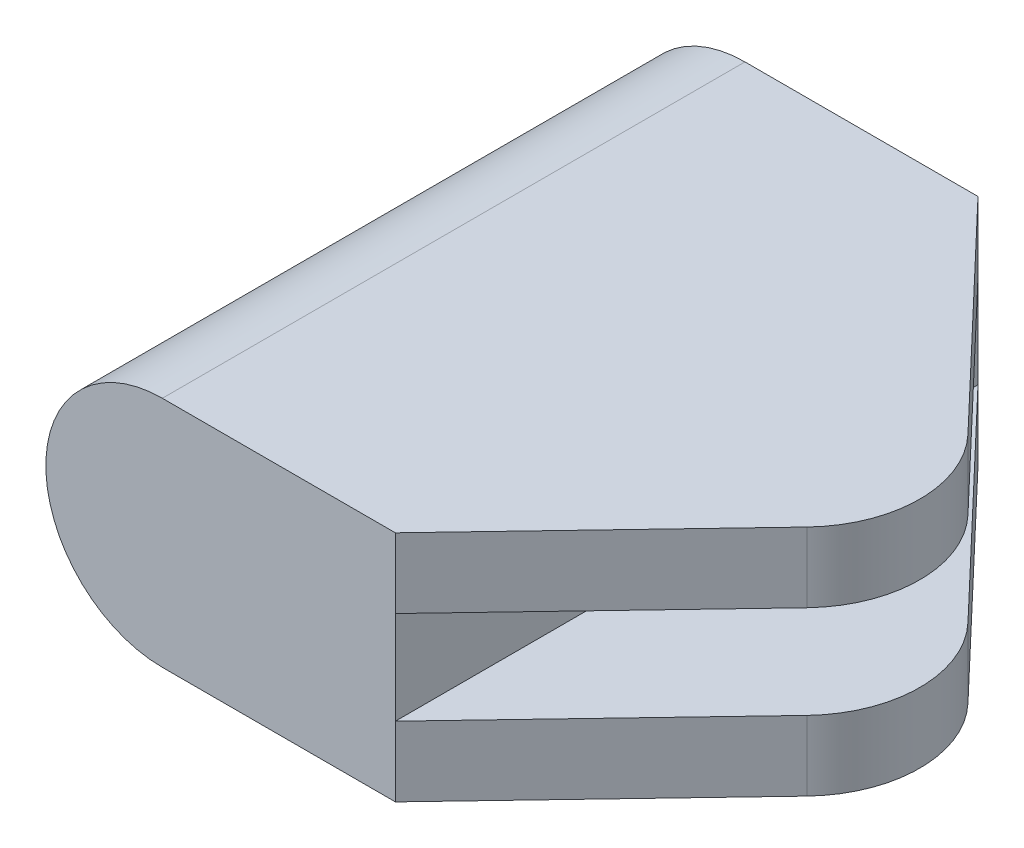
from build123d import *

# Parameters (mm, degrees)
EXTRUDE_1_DEPTH     = 100
CUT_EXTRUDE_1_DEPTH = 100
SKETCH_5_W          = 43.975139672
SKETCH_5_H          = 100.104675822
CUT_EXTRUDE_3_DEPTH = 8


with BuildPart() as part:
    # 草图2 → 凸台-拉伸1 (new body)
    with BuildSketch(Plane.XY):
        with BuildLine():
            Line((0, 20), (80, 20))
            Line((80, 20), (80, -20))
            Line((80, -20), (0, -20))
            ThreePointArc((0, -20), (-20, 0), (0, 20))
        make_face()
    extrude(amount=EXTRUDE_1_DEPTH)

    # 草图3 → 切除-拉伸1 (cut)
    with BuildSketch(Plane(origin=(0, 20, 0), x_dir=(1, 0, 0), z_dir=(0, 1, 0))):
        with BuildLine():
            Line((40, 0), (74.482758502, -36.206896811))
            ThreePointArc((74.482758502, -36.206896811), (79.999999735, -50), (74.482758502, -63.793103189))
            Line((74.482758502, -63.793103189), (40, -100))
            Line((40, -100), (91.714369415, -100))
            Line((91.714369415, -100), (91.714369415, 0))
            Line((91.714369415, 0), (40, 0))
        make_face()
    extrude(amount=-CUT_EXTRUDE_1_DEPTH, mode=Mode.SUBTRACT)

    # 草图5 → 切除-拉伸3 (cut, symmetric)
    with BuildSketch(Plane(origin=(0, 0, 0), x_dir=(1, 0, 0), z_dir=(0, 1, 0))):
        with Locations((61.987569836, -50.052337911)):
            Rectangle(SKETCH_5_W, SKETCH_5_H)
    extrude(amount=CUT_EXTRUDE_3_DEPTH, both=True, mode=Mode.SUBTRACT)


solid = part.part
